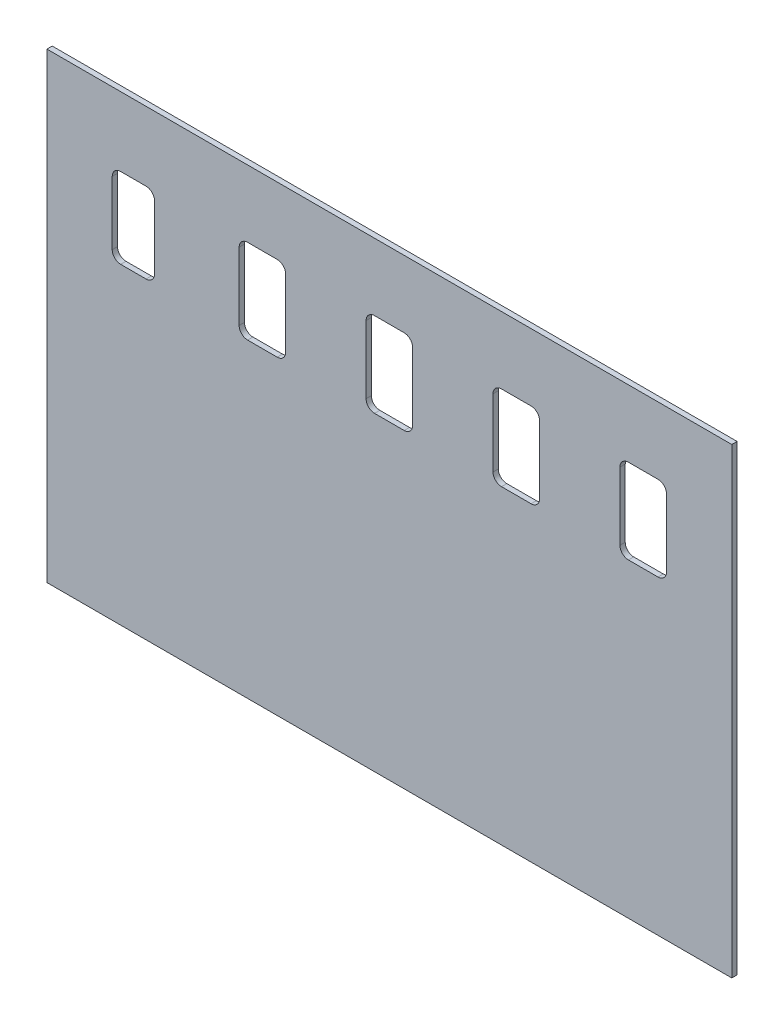
from build123d import *

# Parameters (mm, degrees)
SKETCH3_W           = 411.1625
SKETCH3_H           = 277.368
BOSS_EXTRUDE1_DEPTH = 1.5875
CUT_EXTRUDE1_DEPTH  = 25.4


with BuildPart() as part:
    # Sketch3 → Boss-Extrude1 (new, symmetric)
    with BuildSketch(Plane.XY):
        Rectangle(SKETCH3_W, SKETCH3_H)
    extrude(amount=BOSS_EXTRUDE1_DEPTH, both=True)

    # Sketch4 → Cut-Extrude1 (cut)
    with BuildSketch(Plane.XY.offset(1.5875)):
        with BuildLine():
            Line((-8.89, 98.4326708), (8.89, 98.4326708))
            ThreePointArc((8.89, 98.4326708), (12.482102448, 96.944773248), (13.97, 93.3526708))
            Line((13.97, 93.3526708), (13.97, 52.7126708))
            ThreePointArc((13.97, 52.7126708), (12.482102448, 49.120568352), (8.89, 47.6326708))
            Line((8.89, 47.6326708), (-8.89, 47.6326708))
            ThreePointArc((-8.89, 47.6326708), (-12.482102448, 49.120568352), (-13.97, 52.7126708))
            Line((-13.97, 52.7126708), (-13.97, 93.3526708))
            ThreePointArc((-13.97, 93.3526708), (-12.482102448, 96.944773248), (-8.89, 98.4326708))
        make_face()
        with BuildLine():
            Line((67.31, 98.4326708), (85.09, 98.4326708))
            ThreePointArc((85.09, 98.4326708), (88.682102448, 96.944773248), (90.17, 93.3526708))
            Line((90.17, 93.3526708), (90.17, 52.7126708))
            ThreePointArc((90.17, 52.7126708), (88.682102448, 49.120568352), (85.09, 47.6326708))
            Line((85.09, 47.6326708), (67.31, 47.6326708))
            ThreePointArc((67.31, 47.6326708), (63.717897552, 49.120568352), (62.23, 52.7126708))
            Line((62.23, 52.7126708), (62.23, 93.3526708))
            ThreePointArc((62.23, 93.3526708), (63.717897552, 96.944773248), (67.31, 98.4326708))
        make_face()
        with BuildLine():
            Line((143.51, 98.4326708), (161.29, 98.4326708))
            ThreePointArc((161.29, 98.4326708), (164.882102448, 96.944773248), (166.37, 93.3526708))
            Line((166.37, 93.3526708), (166.37, 52.7126708))
            ThreePointArc((166.37, 52.7126708), (164.882102448, 49.120568352), (161.29, 47.6326708))
            Line((161.29, 47.6326708), (143.51, 47.6326708))
            ThreePointArc((143.51, 47.6326708), (139.917897552, 49.120568352), (138.43, 52.7126708))
            Line((138.43, 52.7126708), (138.43, 93.3526708))
            ThreePointArc((138.43, 93.3526708), (139.917897552, 96.944773248), (143.51, 98.4326708))
        make_face()
        with BuildLine():
            Line((-85.09, 98.4326708), (-67.31, 98.4326708))
            ThreePointArc((-67.31, 98.4326708), (-63.717897552, 96.944773248), (-62.23, 93.3526708))
            Line((-62.23, 93.3526708), (-62.23, 52.7126708))
            ThreePointArc((-62.23, 52.7126708), (-63.717897552, 49.120568352), (-67.31, 47.6326708))
            Line((-67.31, 47.6326708), (-85.09, 47.6326708))
            ThreePointArc((-85.09, 47.6326708), (-88.682102448, 49.120568352), (-90.17, 52.7126708))
            Line((-90.17, 52.7126708), (-90.17, 93.3526708))
            ThreePointArc((-90.17, 93.3526708), (-88.682102448, 96.944773248), (-85.09, 98.4326708))
        make_face()
        with BuildLine():
            Line((-161.29, 97.1626708), (-146.05, 97.1626708))
            ThreePointArc((-146.05, 97.1626708), (-142.457897552, 95.674773248), (-140.97, 92.0826708))
            Line((-140.97, 92.0826708), (-140.97, 53.9826708))
            ThreePointArc((-140.97, 53.9826708), (-142.457897552, 50.390568352), (-146.05, 48.9026708))
            Line((-146.05, 48.9026708), (-161.29, 48.9026708))
            ThreePointArc((-161.29, 48.9026708), (-164.882102448, 50.390568352), (-166.37, 53.9826708))
            Line((-166.37, 53.9826708), (-166.37, 92.0826708))
            ThreePointArc((-166.37, 92.0826708), (-164.882102448, 95.674773248), (-161.29, 97.1626708))
        make_face()
    extrude(amount=-CUT_EXTRUDE1_DEPTH, mode=Mode.SUBTRACT)


solid = part.part
